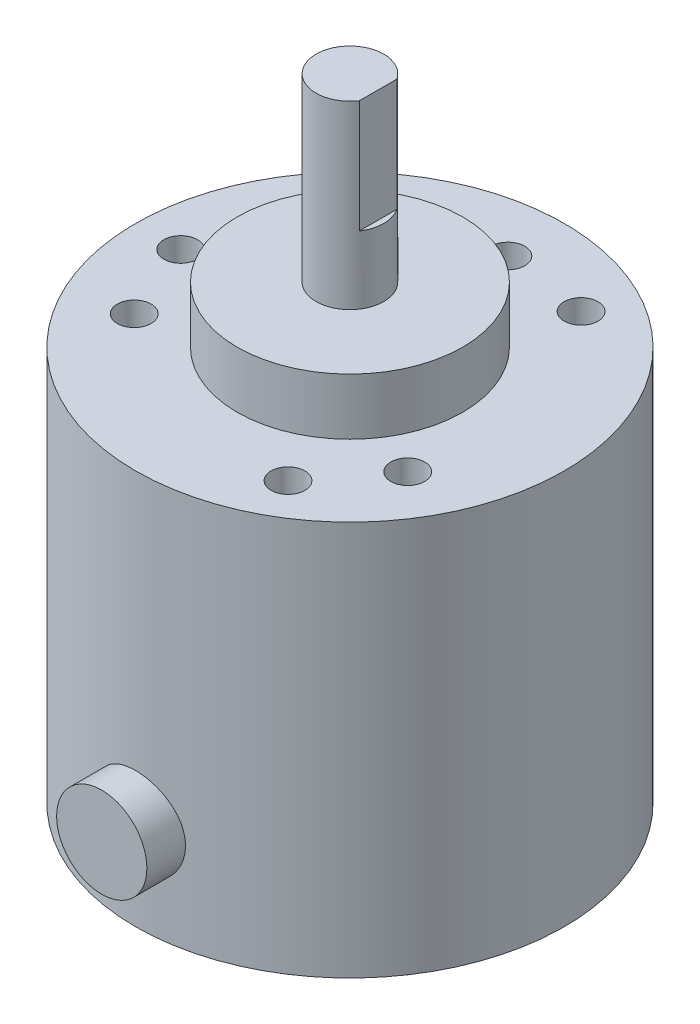
from build123d import *

# Parameters (mm, degrees)
SKETCH2_R           = 19
BOSS_EXTRUDE2_DEPTH = 35
SKETCH4_R           = 10
BOSS_EXTRUDE3_DEPTH = 5
SKETCH5_R           = 3
BOSS_EXTRUDE4_DEPTH = 16
SKETCH8_W           = 0.5
SKETCH8_H           = 6.116200225
CUT_EXTRUDE2_DEPTH  = 10
SKETCH10_R          = 1.5
CUT_EXTRUDE3_DEPTH  = 7
SKETCH15_R          = 4
BOSS_EXTRUDE5_DEPTH = 22


with BuildPart() as part:
    # Sketch2 → Boss-Extrude2 (new body)
    with BuildSketch(Plane(origin=(0, 0, 0), x_dir=(1, 0, 0), z_dir=(0, 1, 0))):
        with Locations(Location((0, 0, 0), (0, 0, 270))):
            Circle(SKETCH2_R)
    extrude(amount=-BOSS_EXTRUDE2_DEPTH)

    # Sketch4 → Boss-Extrude3 (add)
    with BuildSketch(Plane(origin=(0, 0, 0), x_dir=(1, 0, 0), z_dir=(0, 1, 0))):
        with Locations(Location((0, 0, 0), (0, 0, 270))):
            Circle(SKETCH4_R)
    extrude(amount=BOSS_EXTRUDE3_DEPTH)

    # Sketch5 → Boss-Extrude4 (add)
    with BuildSketch(Plane(origin=(0, 5, 0), x_dir=(1, 0, 0), z_dir=(0, 1, 0))):
        with Locations(Location((0, 0, 0), (0, 0, 270))):
            Circle(SKETCH5_R)
    extrude(amount=BOSS_EXTRUDE4_DEPTH)

    # Sketch8 → Cut-Extrude2 (cut)
    with BuildSketch(Plane(origin=(0, 21, 0), x_dir=(1, 0, 0), z_dir=(0, 1, 0))):
        with Locations((2.75, -0.083275924)):
            Rectangle(SKETCH8_W, SKETCH8_H)
    extrude(amount=-CUT_EXTRUDE2_DEPTH, mode=Mode.SUBTRACT)

    # Sketch10 → Cut-Extrude3 (cut)
    with BuildSketch(Plane(origin=(0, 0, 0), x_dir=(1, 0, 0), z_dir=(0, 1, 0))):
        with Locations(Location((-15, 0, 0), (0, 0, 270))):
            Circle(SKETCH10_R)
        with Locations(Location((0, 14, 0), (0, 0, 270))):
            Circle(SKETCH10_R)
        with Locations(Location((7.5, 12.990381057, 0), (0, 0, 270))):
            Circle(SKETCH10_R)
        with Locations(Location((7.5, -12.990381057, 0), (0, 0, 270))):
            Circle(SKETCH10_R)
        with Locations(Location((12.124355653, -7, 0), (0, 0, 270))):
            Circle(SKETCH10_R)
        with Locations(Location((-12.124355653, -7, 0), (0, 0, 270))):
            Circle(SKETCH10_R)
    extrude(amount=-CUT_EXTRUDE3_DEPTH, mode=Mode.SUBTRACT)

    # Sketch15 → Boss-Extrude5 (add)
    with BuildSketch(Plane.XY):
        with Locations(Location((0, -27, 0), (0, 0, 90))):
            Circle(SKETCH15_R)
    extrude(amount=BOSS_EXTRUDE5_DEPTH)


solid = part.part
